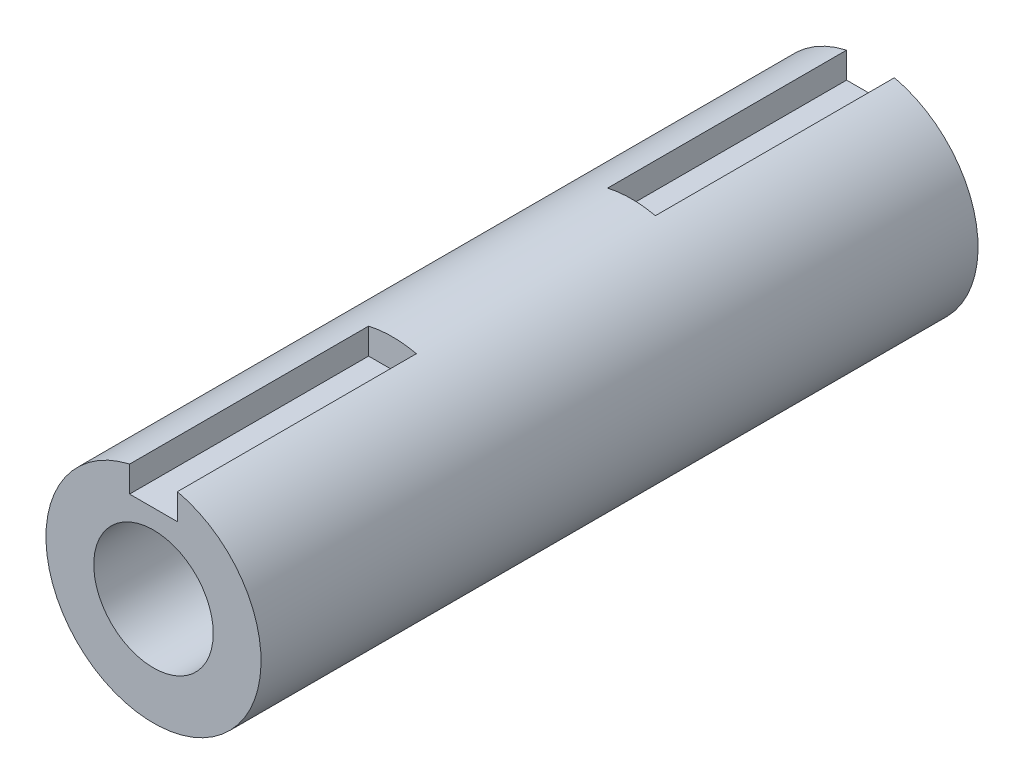
from build123d import *

# Parameters (mm, degrees)
SKETCH1_R           = 22.5
SKETCH1_R_2         = 12.5
BOSS_EXTRUDE1_DEPTH = 75
SKETCH2_W           = 10
SKETCH2_H           = 19.424824541
CUT_EXTRUDE1_DEPTH  = 50


with BuildPart() as part:
    # Sketch1 → Boss-Extrude1 (new, symmetric)
    with BuildSketch(Plane.XY):
        Circle(SKETCH1_R)
        Circle(SKETCH1_R_2, mode=Mode.SUBTRACT)
    extrude(amount=BOSS_EXTRUDE1_DEPTH, both=True)

    # Sketch2 → Cut-Extrude1 (cut)
    with BuildSketch(Plane.XY.offset(75)):
        with Locations((0, 26.21241227)):
            Rectangle(SKETCH2_W, SKETCH2_H)
    cut_extrude1 = extrude(amount=-CUT_EXTRUDE1_DEPTH, mode=Mode.SUBTRACT)

    # Mirror1: Cut-Extrude1 across plane
    add(cut_extrude1.mirror(Plane.XY), mode=Mode.SUBTRACT)


solid = part.part
